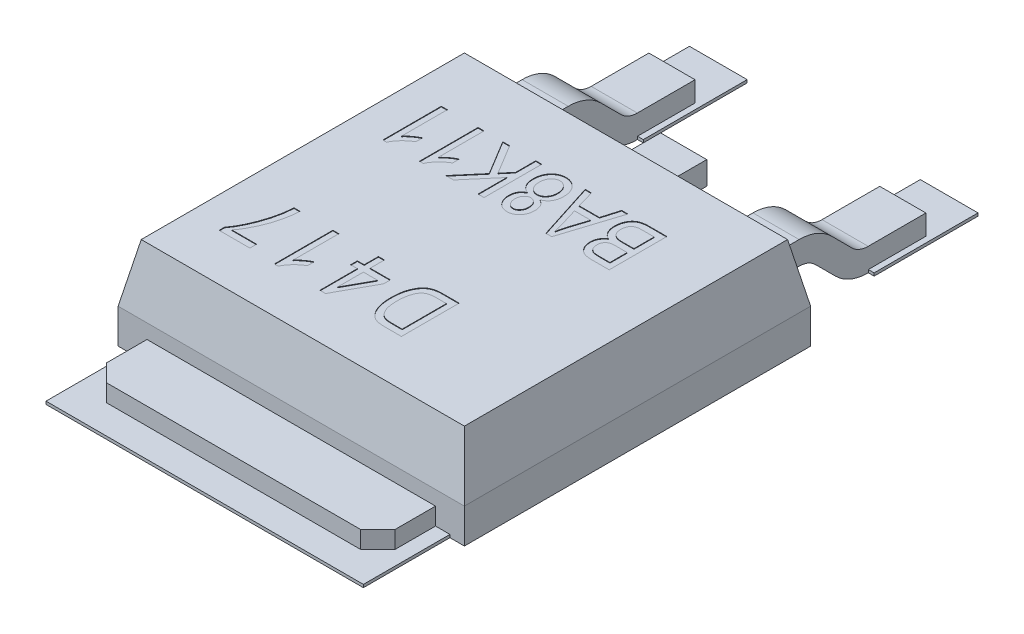
from build123d import *
from OCP.BRepFilletAPI import BRepFilletAPI_MakeChamfer

# Parameters (mm, degrees)
SKETCH1_W           = 6
SKETCH1_H           = 6
BOSS_EXTRUDE1_DEPTH = 1.6
CHAMFER1_SIZE       = 1
CHAMFER1_SIZE2      = 0.2
BOSS_EXTRU_1_DEPTH  = 0.35
SKETCH4_W           = 5.5
SKETCH4_H           = 2
SKETCH4_W_2         = 1
SKETCH4_H_2         = 1.8
BOSS_EXTRUDE2_DEPTH = 0.05
CUT_EXTRUDE1_DEPTH  = 0.01
CUT_EXTRUDE2_DEPTH  = 0.01
EXTRU_MINCE1_DEPTH  = 0.4
ESQUISSE3_W         = 1
ESQUISSE3_H         = 0.4
EXTRU_MINCE2_DEPTH  = 0.4


with BuildPart() as part:
    # Sketch1 → Boss-Extrude1 (new body)
    with BuildSketch(Plane(origin=(0, 0, 0), x_dir=(1, 0, 0), z_dir=(0, 1, 0))):
        Rectangle(SKETCH1_W, SKETCH1_H)
    extrude(amount=BOSS_EXTRUDE1_DEPTH)

    # Chamfer1: one chamfer whose edges measure the first distance from different faces: ONE call of the kernel's chamfer builder (chamfer() names one face for all edges)
    chamfer1_edges_1 = [part.edges().sort_by_distance(p)[0] for p in [
        (3, 1.6, 0),
    ]]
    chamfer1_side_1 = [part.faces().sort_by_distance(p)[0] for p in [
        (3, 0.8, 0),
    ]]
    chamfer1_edges_2 = [part.edges().sort_by_distance(p)[0] for p in [
        (0, 1.6, -3),
    ]]
    chamfer1_side_2 = [part.faces().sort_by_distance(p)[0] for p in [
        (0, 0.8, -3),
    ]]
    chamfer1_edges_3 = [part.edges().sort_by_distance(p)[0] for p in [
        (-3, 1.6, 0),
    ]]
    chamfer1_side_3 = [part.faces().sort_by_distance(p)[0] for p in [
        (-3, 0.8, 0),
    ]]
    chamfer1_edges_4 = [part.edges().sort_by_distance(p)[0] for p in [
        (0, 1.6, 3),
    ]]
    chamfer1_side_4 = [part.faces().sort_by_distance(p)[0] for p in [
        (0, 0.8, 3),
    ]]
    chamfer1 = BRepFilletAPI_MakeChamfer(part.part.solid().wrapped)
    for e in chamfer1_edges_1:
        chamfer1.Add(CHAMFER1_SIZE, CHAMFER1_SIZE2, e.wrapped, chamfer1_side_1[0].wrapped)  # the first distance lies on this face
    for e in chamfer1_edges_2:
        chamfer1.Add(CHAMFER1_SIZE, CHAMFER1_SIZE2, e.wrapped, chamfer1_side_2[0].wrapped)  # the first distance lies on this face
    for e in chamfer1_edges_3:
        chamfer1.Add(CHAMFER1_SIZE, CHAMFER1_SIZE2, e.wrapped, chamfer1_side_3[0].wrapped)  # the first distance lies on this face
    for e in chamfer1_edges_4:
        chamfer1.Add(CHAMFER1_SIZE, CHAMFER1_SIZE2, e.wrapped, chamfer1_side_4[0].wrapped)  # the first distance lies on this face
    add(Compound.cast(chamfer1.Shape()), mode=Mode.REPLACE)

    # Esquisse1 → Boss.-Extru.1 (add)
    with BuildSketch(Plane.XZ):
        Polygon((-2.5, 3), (-2.5, 3.7), (-2.2, 4), (2.2, 4), (2.5, 3.7), (2.5, 3), align=None)
    extrude(amount=-BOSS_EXTRU_1_DEPTH)

    # Sketch4 → Boss-Extrude2 (add)
    with BuildSketch(Plane(origin=(0, 0, 0), x_dir=(1, 0, 0), z_dir=(0, 1, 0))):
        with Locations((0, -3.5)):
            Rectangle(SKETCH4_W, SKETCH4_H)
        with Locations((-2, 5.5)):
            Rectangle(SKETCH4_W_2, SKETCH4_H_2)
        with Locations((2, 5.5)):
            Rectangle(SKETCH4_W_2, SKETCH4_H_2)
    extrude(amount=BOSS_EXTRUDE2_DEPTH)


with BuildPart() as boss_extrude2_piece_1:
    # of the separate pieces the step leaves, piece 1, a body of its own (boss_extrude2_pieces)
    add(part.part.solids().sort_by_distance((-3, 0.6, -3))[0])

    # Sketch5 → Cut-Extrude1 (cut)
    # profile 1 of 4: a face of its own
    with BuildSketch(Plane(origin=(0, 1.6, 0), x_dir=(1, 0, 0), z_dir=(0, 1, 0))):
        with BuildLine():
            Line((0.909090909, -1), (0.909090909, -2))
            Line((0.909090909, -2), (0.627232143, -2))
            add(Edge.make_bspline(
                [(0.627232143, -2), (0.618775412, -2.00000451), (0.60239621, -2.000013245), (0.578587199, -1.998844327), (0.556316091, -1.997536776), (0.535597034, -1.995541178), (0.516529087, -1.992843094), (0.498939821, -1.989939618), (0.482975595, -1.986074805), (0.472930515, -1.983000063), (0.468141234, -1.981534091)],
                knots=[0, 0, 0, 0, 1.262174937, 2.444611131, 3.557536157, 4.59237566, 5.550534478, 6.431992477, 7.252407118, 8, 8, 8, 8], degree=3))
            add(Edge.make_bspline(
                [(0.468141234, -1.981534091), (0.456481577, -1.977077241), (0.433154022, -1.96816039), (0.400785725, -1.948392912), (0.370967262, -1.923721279), (0.343505704, -1.894318821), (0.318800848, -1.860334626), (0.297135486, -1.822023974), (0.278003099, -1.779895789), (0.26197546, -1.733511256), (0.249196519, -1.682818235), (0.240254127, -1.627627934), (0.23471847, -1.568024588), (0.234090817, -1.526798491), (0.233766234, -1.505478896)],
                knots=[0, 0, 0, 0, 0.793570228, 1.587701398, 2.401757725, 3.251990999, 4.14284781, 5.070886882, 6.05016333, 7.085482446, 8.191842001, 9.375152492, 10.642590783, 12, 12, 12, 12], degree=3))
            add(Edge.make_bspline(
                [(0.233766234, -1.505478896), (0.233936524, -1.491609851), (0.234271511, -1.464327235), (0.236476558, -1.424242192), (0.240312254, -1.385711603), (0.245787602, -1.348883148), (0.252663112, -1.313580679), (0.261094381, -1.279946144), (0.271346301, -1.247947411), (0.282845805, -1.217593758), (0.295542964, -1.189045638), (0.309363547, -1.1626511), (0.323967898, -1.138314333), (0.339601771, -1.116289027), (0.355796369, -1.096150943), (0.373181339, -1.078498187), (0.391220094, -1.062685269), (0.410533963, -1.049188647), (0.431048809, -1.03758525), (0.452795028, -1.027390955), (0.476077229, -1.018828152), (0.500887314, -1.012045721), (0.527097788, -1.006515321), (0.554830261, -1.002702364), (0.584041134, -1.000496637), (0.604027564, -1.000168005), (0.61424513, -1)],
                knots=[0, 0, 0, 0, 1.386035777, 2.726552658, 4.010606465, 5.254366226, 6.446193604, 7.603690686, 8.717510246, 9.802231389, 10.846187194, 11.837930809, 12.77813523, 13.6802668, 14.53543628, 15.357642445, 16.153183888, 16.929597682, 17.707687034, 18.506066684, 19.327327497, 20.183458262, 21.074376462, 22.002646263, 22.978902547, 24, 24, 24, 24], degree=3))
            Line((0.61424513, -1), (0.909090909, -1))
        make_face()
        with BuildLine():
            Line((0.805194805, -1.116883117), (0.626826299, -1.116883117))
            add(Edge.make_bspline(
                [(0.626826299, -1.116883117), (0.618097699, -1.117005877), (0.601166151, -1.117244005), (0.576588709, -1.118906443), (0.553598984, -1.12141978), (0.53226459, -1.125313856), (0.512582747, -1.130105742), (0.494498004, -1.135992591), (0.478070061, -1.143079418), (0.463030763, -1.15126581), (0.44932786, -1.16069055), (0.436604076, -1.171408607), (0.424660749, -1.18336333), (0.413499295, -1.196621802), (0.403028313, -1.211046266), (0.393783985, -1.227072232), (0.384996644, -1.244233052), (0.3799878, -1.256386977), (0.377435065, -1.262581169)],
                knots=[0, 0, 0, 0, 1.342522454, 2.604195873, 3.787640691, 4.897837639, 5.937490788, 6.901507558, 7.81956877, 8.685632238, 9.531204737, 10.37312076, 11.241244131, 12.127141563, 13.036673505, 13.978826353, 14.969918024, 16, 16, 16, 16], degree=3))
            add(Edge.make_bspline(
                [(0.377435065, -1.262581169), (0.374235057, -1.271275904), (0.367767595, -1.28884863), (0.359550223, -1.316254887), (0.353107863, -1.344993201), (0.347201712, -1.374924433), (0.343189551, -1.406125809), (0.339760984, -1.438585087), (0.338026764, -1.472315755), (0.33778495, -1.495263627), (0.337662338, -1.506899351)],
                knots=[0, 0, 0, 0, 0.893151802, 1.805128209, 2.755850574, 3.731738016, 4.745334486, 5.787480394, 6.878141491, 8, 8, 8, 8], degree=3))
            add(Edge.make_bspline(
                [(0.337662338, -1.506899351), (0.337751243, -1.51928112), (0.337924325, -1.543386024), (0.340069251, -1.578512545), (0.343150431, -1.611578414), (0.347889282, -1.64258153), (0.353717899, -1.671581071), (0.3606963, -1.698616756), (0.369273581, -1.723571691), (0.379178025, -1.746475475), (0.390248858, -1.767369446), (0.401717861, -1.786658084), (0.414363885, -1.803853952), (0.42754419, -1.819364746), (0.441467336, -1.833160595), (0.456190791, -1.845094558), (0.471786112, -1.855222075), (0.48275985, -1.860566298), (0.488230519, -1.863230519)],
                knots=[0, 0, 0, 0, 1.456515219, 2.835552549, 4.138945756, 5.362336007, 6.523499621, 7.617953034, 8.644754834, 9.624918001, 10.550413316, 11.425253886, 12.262512803, 13.058355621, 13.818045382, 14.564998839, 15.284617782, 16, 16, 16, 16], degree=3))
            add(Edge.make_bspline(
                [(0.488230519, -1.863230519), (0.492196312, -1.864856582), (0.500541033, -1.868278102), (0.514225775, -1.872201089), (0.529448542, -1.875715827), (0.546367242, -1.878175199), (0.564826162, -1.880463596), (0.584997618, -1.882110126), (0.606800225, -1.882783141), (0.62188835, -1.883003351), (0.629667208, -1.883116883)],
                knots=[0, 0, 0, 0, 0.715292366, 1.505100173, 2.373764653, 3.322734101, 4.358121183, 5.480036167, 6.700803291, 8, 8, 8, 8], degree=3))
            Line((0.629667208, -1.883116883), (0.805194805, -1.883116883))
            Line((0.805194805, -1.883116883), (0.805194805, -1.116883117))
        make_face(mode=Mode.SUBTRACT)
    # profile 2 of 4: a face of its own
    with BuildSketch(Plane(origin=(0, 1.6, 0), x_dir=(1, 0, 0), z_dir=(0, 1, 0))):
        Polygon((-0.386363636, -1), (-0.386363636, -1.246753247), (-0.035714286, -1.246753247), (-0.035714286, -1.363636364), (-0.392248377, -2.012987013), (-0.49025974, -2.012987013), (-0.49025974, -1.363636364), (-0.607142857, -1.363636364), (-0.607142857, -1.246753247), (-0.49025974, -1.246753247), (-0.49025974, -1), align=None)
        Polygon((-0.386363636, -1.363636364), (-0.386363636, -1.815543831), (-0.138189935, -1.363636364), align=None, mode=Mode.SUBTRACT)
    # profile 3 of 4: a face of its own
    with BuildSketch(Plane(origin=(0, 1.6, 0), x_dir=(1, 0, 0), z_dir=(0, 1, 0))):
        with BuildLine():
            Line((-1.279220779, -1), (-1.175324675, -1))
            Line((-1.175324675, -1), (-1.175324675, -1.792207792))
            add(Edge.make_bspline(
                [(-1.175324675, -1.792207792), (-1.168941155, -1.784866534), (-1.155711315, -1.769651785), (-1.132836194, -1.747977094), (-1.107121801, -1.725961756), (-1.079062769, -1.70412581), (-1.050104506, -1.683443988), (-1.021591711, -1.665041869), (-0.994416181, -1.649140319), (-0.976251606, -1.640507471), (-0.967532468, -1.636363636)],
                knots=[0, 0, 0, 0, 0.892597597, 1.849907605, 2.889096657, 3.999508354, 5.112538398, 6.154543284, 7.114166246, 8, 8, 8, 8], degree=3))
            Line((-0.967532468, -1.636363636), (-0.967532468, -1.753246753))
            add(Edge.make_bspline(
                [(-0.967532468, -1.753246753), (-0.981542686, -1.761684938), (-1.009443158, -1.778489054), (-1.048633979, -1.807549853), (-1.085439436, -1.839249281), (-1.119295093, -1.873145958), (-1.149602414, -1.908063441), (-1.175168336, -1.943201804), (-1.196425732, -1.977703086), (-1.206826798, -2.00149514), (-1.211850649, -2.012987013)],
                knots=[0, 0, 0, 0, 1.082266703, 2.155266233, 3.225308806, 4.295585612, 5.324342242, 6.282751181, 7.17054637, 8, 8, 8, 8], degree=3))
            Line((-1.211850649, -2.012987013), (-1.279220779, -2.012987013))
            Line((-1.279220779, -2.012987013), (-1.279220779, -1))
        make_face()
    # profile 4 of 4: a face of its own
    with BuildSketch(Plane(origin=(0, 1.6, 0), x_dir=(1, 0, 0), z_dir=(0, 1, 0))):
        with BuildLine():
            Line((-1.730519481, -1.87012987), (-1.730519481, -1.987012987))
            Line((-1.730519481, -1.987012987), (-2.262987013, -1.987012987))
            Line((-2.262987013, -1.987012987), (-2.262987013, -1.891436688))
            add(Edge.make_bspline(
                [(-2.262987013, -1.891436688), (-2.253107587, -1.878210031), (-2.232998474, -1.851287786), (-2.204877796, -1.808222134), (-2.177523491, -1.762359182), (-2.150938602, -1.713647147), (-2.125334602, -1.662005922), (-2.100887544, -1.607370332), (-2.077158554, -1.54991053), (-2.054393858, -1.490126812), (-2.033180943, -1.428934513), (-2.014319685, -1.367266072), (-1.997878532, -1.305656703), (-1.983655189, -1.244287077), (-1.971819574, -1.183038154), (-1.962512462, -1.121977409), (-1.955512302, -1.060986446), (-1.952701618, -1.020305417), (-1.951298701, -1)],
                knots=[0, 0, 0, 0, 0.828261285, 1.685887316, 2.579428271, 3.507501538, 4.469891598, 5.471065063, 6.510494938, 7.589089173, 8.680758398, 9.759817177, 10.82439165, 11.879940066, 12.920405774, 13.953938893, 14.978734705, 16, 16, 16, 16], degree=3))
            Line((-1.951298701, -1), (-1.847402597, -1))
            add(Edge.make_bspline(
                [(-1.847402597, -1), (-1.847750245, -1.010689632), (-1.848459293, -1.032491751), (-1.850659887, -1.065872605), (-1.854401087, -1.100508476), (-1.859272188, -1.1365078), (-1.865445265, -1.173762929), (-1.872455889, -1.212439498), (-1.881062772, -1.252330181), (-1.894016685, -1.307156239), (-1.912517131, -1.375703545), (-1.93909059, -1.456512779), (-1.969148541, -1.535436954), (-2.003256405, -1.611554138), (-2.039186803, -1.684140455), (-2.07765803, -1.751351867), (-2.116488053, -1.813642595), (-2.145154103, -1.85165101), (-2.159090909, -1.87012987)],
                knots=[0, 0, 0, 0, 0.547564817, 1.116789984, 1.712252562, 2.330831182, 2.976456312, 3.645516887, 4.343080939, 5.06547646, 6.529779861, 7.976466419, 9.419056042, 10.851576025, 12.245448489, 13.563727135, 14.815537433, 16, 16, 16, 16], degree=3))
            Line((-2.159090909, -1.87012987), (-1.730519481, -1.87012987))
        make_face()
    extrude(amount=-CUT_EXTRUDE1_DEPTH, mode=Mode.SUBTRACT)

    # Sketch6 → Cut-Extrude2 (cut)
    # profile 1 of 6: a face of its own
    with BuildSketch(Plane(origin=(0, 1.6, 0), x_dir=(1, 0, 0), z_dir=(0, 1, 0))):
        with BuildLine():
            Line((1.709090909, 1.8), (1.709090909, 0.8))
            Line((1.709090909, 0.8), (1.399025974, 0.8))
            add(Edge.make_bspline(
                [(1.399025974, 0.8), (1.391379972, 0.800054737), (1.376479609, 0.800161407), (1.35474923, 0.801658249), (1.334234107, 0.803862586), (1.314898025, 0.806818804), (1.296886513, 0.810896293), (1.280041716, 0.815744905), (1.264459217, 0.821633249), (1.245258892, 0.830494742), (1.223120185, 0.844304649), (1.199134695, 0.864843401), (1.177779684, 0.889492317), (1.159040297, 0.917539877), (1.143625845, 0.948366452), (1.132659113, 0.981294216), (1.125938203, 1.015839329), (1.125101346, 1.039417471), (1.124675325, 1.051420455)],
                knots=[0, 0, 0, 0, 0.870762362, 1.696922705, 2.479694412, 3.220704395, 3.923519284, 4.58180529, 5.215744372, 5.818975064, 6.988484834, 8.174326093, 9.402850172, 10.691394685, 12.007628492, 13.315991423, 14.633645104, 16, 16, 16, 16], degree=3))
            add(Edge.make_bspline(
                [(1.124675325, 1.051420455), (1.125012224, 1.062469532), (1.125673818, 1.084167395), (1.131294903, 1.115801747), (1.140432431, 1.145758504), (1.153339228, 1.173770644), (1.169199712, 1.19991493), (1.18879568, 1.223013033), (1.210790177, 1.244063188), (1.227706367, 1.255327982), (1.236282468, 1.261038961)],
                knots=[0, 0, 0, 0, 1.067163608, 2.095665496, 3.094381775, 4.086055985, 5.069334826, 6.039400011, 7.006023047, 8, 8, 8, 8], degree=3))
            add(Edge.make_bspline(
                [(1.236282468, 1.261038961), (1.22600209, 1.265827966), (1.205531205, 1.275364113), (1.178368523, 1.29598836), (1.15440453, 1.320887189), (1.134393073, 1.35051673), (1.118310935, 1.384223727), (1.106796572, 1.421742795), (1.099812443, 1.462889136), (1.099080571, 1.49152962), (1.098701299, 1.506371753)],
                knots=[0, 0, 0, 0, 0.907806387, 1.807676924, 2.717428127, 3.670336734, 4.663211712, 5.703492116, 6.809898713, 8, 8, 8, 8], degree=3))
            add(Edge.make_bspline(
                [(1.098701299, 1.506371753), (1.099078652, 1.521283338), (1.099811987, 1.550262045), (1.106983705, 1.592270609), (1.118188705, 1.631554649), (1.134224832, 1.66761609), (1.154018015, 1.699906758), (1.177096466, 1.727895878), (1.203311481, 1.751153558), (1.227873534, 1.766535285), (1.249305953, 1.77614511), (1.266729866, 1.782748339), (1.285740342, 1.787857683), (1.306033096, 1.792382826), (1.327857783, 1.795816529), (1.351100626, 1.798103731), (1.375730043, 1.799903222), (1.39259649, 1.799967164), (1.401258117, 1.8)],
                knots=[0, 0, 0, 0, 1.483101461, 2.882213003, 4.228804869, 5.540004403, 6.797554673, 7.988070595, 9.137672878, 10.271731903, 10.856259808, 11.474079914, 12.124255131, 12.813652303, 13.543114926, 14.321609254, 15.138076009, 16, 16, 16, 16], degree=3))
            Line((1.401258117, 1.8), (1.709090909, 1.8))
        make_face()
        with BuildLine():
            Line((1.605194805, 1.215584416), (1.421753247, 1.215584416))
            add(Edge.make_bspline(
                [(1.421753247, 1.215584416), (1.410653992, 1.215504138), (1.390129319, 1.215355689), (1.361987025, 1.213421056), (1.338789187, 1.211138), (1.325406025, 1.207609396), (1.319480519, 1.206047078)],
                knots=[0, 0, 0, 0, 1.292436319, 2.38996507, 3.287143691, 4, 4, 4, 4], degree=3))
            add(Edge.make_bspline(
                [(1.319480519, 1.206047078), (1.312542258, 1.203575452), (1.298988065, 1.198747023), (1.28083443, 1.187697451), (1.26482608, 1.17461566), (1.251549462, 1.15881063), (1.240829716, 1.140289002), (1.233795941, 1.118658579), (1.229198572, 1.094228534), (1.228787545, 1.076944839), (1.228571429, 1.067857143)],
                knots=[0, 0, 0, 0, 0.985455176, 1.925129435, 2.833409245, 3.74751417, 4.678036112, 5.68496882, 6.782766118, 8, 8, 8, 8], degree=3))
            add(Edge.make_bspline(
                [(1.228571429, 1.067857143), (1.228830522, 1.059315913), (1.229327246, 1.042940959), (1.233478133, 1.019477123), (1.240087212, 0.998185735), (1.2494136, 0.979214978), (1.261076363, 0.962840987), (1.274599342, 0.949004357), (1.2899696, 0.93796315), (1.304319142, 0.930893334), (1.3173713, 0.927006428), (1.328912934, 0.924086669), (1.342370093, 0.921981149), (1.357544365, 0.920246836), (1.37444135, 0.918498491), (1.39313363, 0.917619635), (1.413564079, 0.916981608), (1.427772613, 0.916916766), (1.435146104, 0.916883117)],
                knots=[0, 0, 0, 0, 1.374823033, 2.635763691, 3.824462367, 4.954815379, 6.024974192, 7.049578075, 8.056420344, 9.060192966, 9.608067978, 10.247510764, 10.976465608, 11.799414685, 12.707848295, 13.711620916, 14.812450139, 16, 16, 16, 16], degree=3))
            Line((1.435146104, 0.916883117), (1.605194805, 0.916883117))
            Line((1.605194805, 0.916883117), (1.605194805, 1.215584416))
        make_face(mode=Mode.SUBTRACT)
        with BuildLine():
            Line((1.605194805, 1.683116883), (1.399025974, 1.683116883))
            add(Edge.make_bspline(
                [(1.399025974, 1.683116883), (1.388401593, 1.682961147), (1.368614295, 1.682671096), (1.341133252, 1.680603566), (1.31801264, 1.676848839), (1.304495734, 1.672503054), (1.298376623, 1.670535714)],
                knots=[0, 0, 0, 0, 1.250964288, 2.329849019, 3.243921745, 4, 4, 4, 4], degree=3))
            add(Edge.make_bspline(
                [(1.298376623, 1.670535714), (1.290859518, 1.667282728), (1.276193291, 1.660935997), (1.256844935, 1.647017306), (1.239879566, 1.630785821), (1.226253555, 1.611185955), (1.215635897, 1.588885306), (1.207946016, 1.564023054), (1.203532087, 1.536424303), (1.202917918, 1.517210521), (1.202597403, 1.507183442)],
                knots=[0, 0, 0, 0, 0.967993686, 1.888601442, 2.806833432, 3.738608885, 4.699374536, 5.72357697, 6.812005123, 8, 8, 8, 8], degree=3))
            add(Edge.make_bspline(
                [(1.202597403, 1.507183442), (1.202829078, 1.497896151), (1.203276768, 1.479949339), (1.207868279, 1.454178508), (1.215104403, 1.430588423), (1.225295109, 1.409313134), (1.238065552, 1.390582178), (1.253137342, 1.374614588), (1.26987555, 1.36091141), (1.285804804, 1.352046381), (1.299981138, 1.346382429), (1.312025001, 1.342524545), (1.325641811, 1.339588785), (1.340523686, 1.336941513), (1.356848319, 1.334921668), (1.374525439, 1.333613795), (1.393600033, 1.332453516), (1.406802604, 1.332462752), (1.413636364, 1.332467532)],
                knots=[0, 0, 0, 0, 1.410573788, 2.725800822, 3.964903627, 5.151480749, 6.298041429, 7.396564004, 8.478942006, 9.57457322, 10.151232655, 10.798392405, 11.494360327, 12.266936039, 13.095957466, 13.993447348, 14.961391824, 16, 16, 16, 16], degree=3))
            Line((1.413636364, 1.332467532), (1.605194805, 1.332467532))
            Line((1.605194805, 1.332467532), (1.605194805, 1.683116883))
        make_face(mode=Mode.SUBTRACT)
    # profile 2 of 6: a face of its own
    with BuildSketch(Plane(origin=(0, 1.6, 0), x_dir=(1, 0, 0), z_dir=(0, 1, 0))):
        Polygon((1.033766234, 1.8), (0.714366883, 0.8), (0.613108766, 0.8), (0.293506494, 1.8), (0.401461039, 1.8), (0.488920455, 1.501298701), (0.838352273, 1.501298701), (0.925608766, 1.8), align=None)
        with BuildLine():
            Line((0.804261364, 1.384415584), (0.523214286, 1.384415584))
            Line((0.523214286, 1.384415584), (0.606818182, 1.109659091))
            add(Edge.make_bspline(
                [(0.606818182, 1.109659091), (0.609943302, 1.099381806), (0.616044644, 1.079316904), (0.624726603, 1.049947394), (0.632908616, 1.022030462), (0.640419515, 0.99560057), (0.647062127, 0.970607104), (0.653235429, 0.947157072), (0.658669278, 0.925160817), (0.662024566, 0.910933488), (0.663636364, 0.904099026)],
                knots=[0, 0, 0, 0, 1.208585302, 2.359586633, 3.44573617, 4.481694954, 5.45087266, 6.355352717, 7.20995158, 8, 8, 8, 8], degree=3))
            add(Edge.make_bspline(
                [(0.663636364, 0.904099026), (0.666559949, 0.920019234), (0.672403236, 0.951838502), (0.683356248, 0.999239199), (0.695541806, 1.04655436), (0.705241061, 1.077769848), (0.710105519, 1.093425325)],
                knots=[0, 0, 0, 0, 0.995500629, 1.989678841, 2.991765375, 4, 4, 4, 4], degree=3))
            Line((0.710105519, 1.093425325), (0.804261364, 1.384415584))
        make_face(mode=Mode.SUBTRACT)
    # profile 3 of 6: a face of its own
    with BuildSketch(Plane(origin=(0, 1.6, 0), x_dir=(1, 0, 0), z_dir=(0, 1, 0))):
        with BuildLine():
            add(Edge.make_bspline(
                [(0.055073052, 1.251298701), (0.06462921, 1.246491383), (0.083273438, 1.237112222), (0.108139677, 1.218830253), (0.12914444, 1.19737835), (0.146566292, 1.172965679), (0.160360127, 1.145492643), (0.169686672, 1.114812189), (0.175815864, 1.081223702), (0.176347218, 1.057740526), (0.176623377, 1.045535714)],
                knots=[0, 0, 0, 0, 1.008509637, 1.967619574, 2.89776806, 3.831547644, 4.788167516, 5.785783694, 6.849214744, 8, 8, 8, 8], degree=3))
            add(Edge.make_bspline(
                [(0.176623377, 1.045535714), (0.176437496, 1.036192949), (0.176074127, 1.01792923), (0.172968249, 0.99118185), (0.167878134, 0.96582057), (0.161102457, 0.941683442), (0.151850327, 0.919021466), (0.140609062, 0.89768413), (0.127678992, 0.87738583), (0.112439714, 0.85891933), (0.095911173, 0.842089289), (0.078177815, 0.827378272), (0.059412853, 0.814910076), (0.039612401, 0.804691252), (0.018781155, 0.796754339), (-0.003104633, 0.790979993), (-0.02607062, 0.787808644), (-0.041711805, 0.78728051), (-0.04963474, 0.787012987)],
                knots=[0, 0, 0, 0, 1.165741532, 2.278851694, 3.354982323, 4.391648623, 5.402771003, 6.403407807, 7.398581389, 8.400606014, 9.38555839, 10.33889109, 11.270751962, 12.191998689, 13.113864065, 14.047558559, 15.011004111, 16, 16, 16, 16], degree=3))
            add(Edge.make_bspline(
                [(-0.04963474, 0.787012987), (-0.057628477, 0.787257493), (-0.073420297, 0.787740521), (-0.096550565, 0.79124631), (-0.118652568, 0.796951233), (-0.13974026, 0.804861825), (-0.159695435, 0.815329769), (-0.178664421, 0.827989647), (-0.196651133, 0.84291662), (-0.213354584, 0.860076787), (-0.228476677, 0.879063823), (-0.241802257, 0.899480577), (-0.252942164, 0.921272034), (-0.262145499, 0.94436096), (-0.269241336, 0.968830901), (-0.274246983, 0.994639674), (-0.27736951, 1.021717189), (-0.277735543, 1.040183505), (-0.277922078, 1.049594156)],
                knots=[0, 0, 0, 0, 0.984942696, 1.945778183, 2.875853341, 3.793971666, 4.714923987, 5.646678758, 6.59981698, 7.590177482, 8.592638326, 9.586885563, 10.589796896, 11.603734109, 12.645759419, 13.72477449, 14.840518438, 16, 16, 16, 16], degree=3))
            add(Edge.make_bspline(
                [(-0.277922078, 1.049594156), (-0.277623933, 1.061322759), (-0.277049626, 1.083915245), (-0.271179536, 1.116373217), (-0.26194147, 1.146057318), (-0.248872785, 1.173038658), (-0.231761321, 1.197212749), (-0.21060629, 1.218269845), (-0.185967661, 1.23704401), (-0.16723645, 1.246452851), (-0.157589286, 1.251298701)],
                knots=[0, 0, 0, 0, 1.126050265, 2.169079615, 3.157896424, 4.105607084, 5.038058818, 5.989507118, 6.964532763, 8, 8, 8, 8], degree=3))
            add(Edge.make_bspline(
                [(-0.157589286, 1.251298701), (-0.163863221, 1.253825326), (-0.176231325, 1.258806179), (-0.193694264, 1.268119642), (-0.210261126, 1.278221263), (-0.225636349, 1.289600489), (-0.239975187, 1.301999742), (-0.253009459, 1.315720356), (-0.264955392, 1.330559912), (-0.275937671, 1.34638906), (-0.285802125, 1.36328233), (-0.29396598, 1.381383717), (-0.30120549, 1.400307772), (-0.306800686, 1.420303094), (-0.311283836, 1.441245123), (-0.314456736, 1.463142164), (-0.316616901, 1.486036367), (-0.316792954, 1.501631656), (-0.316883117, 1.509618506)],
                knots=[0, 0, 0, 0, 0.998651006, 1.968687807, 2.92001032, 3.863478588, 4.791415673, 5.717413269, 6.655466888, 7.60358177, 8.561808628, 9.541119464, 10.534204117, 11.552808826, 12.605410886, 13.696544253, 14.820325946, 16, 16, 16, 16], degree=3))
            add(Edge.make_bspline(
                [(-0.316883117, 1.509618506), (-0.316663065, 1.520520039), (-0.316231243, 1.54191283), (-0.312439175, 1.573184234), (-0.306647737, 1.603015311), (-0.29832938, 1.631293039), (-0.287576764, 1.658036037), (-0.274229477, 1.683094202), (-0.258839409, 1.706796325), (-0.240962695, 1.72858043), (-0.221513755, 1.748346409), (-0.200588919, 1.765556267), (-0.17861842, 1.780268663), (-0.155390732, 1.792391575), (-0.130846761, 1.801406032), (-0.105347592, 1.80828286), (-0.078630747, 1.812079167), (-0.060468204, 1.81268155), (-0.051258117, 1.812987013)],
                knots=[0, 0, 0, 0, 1.159839339, 2.276028545, 3.347612162, 4.390892238, 5.408217009, 6.409728542, 7.408078517, 8.410986246, 9.403635706, 10.354881406, 11.289307082, 12.213387266, 13.136008139, 14.066710435, 15.019643562, 16, 16, 16, 16], degree=3))
            add(Edge.make_bspline(
                [(-0.051258117, 1.812987013), (-0.041912383, 1.812684937), (-0.023546717, 1.812091316), (0.003434463, 1.808274575), (0.029089632, 1.801452219), (0.053723163, 1.792332286), (0.077089426, 1.780341376), (0.099097415, 1.765482672), (0.1202067, 1.748421154), (0.139666409, 1.728576225), (0.157560972, 1.706701961), (0.173199517, 1.683001557), (0.186263619, 1.657510294), (0.197063592, 1.630485334), (0.205289841, 1.601701102), (0.211497041, 1.571330766), (0.214838686, 1.539252774), (0.21533269, 1.517336533), (0.215584416, 1.506168831)],
                knots=[0, 0, 0, 0, 0.98489838, 1.935462181, 2.863853923, 3.777350714, 4.698628449, 5.623813301, 6.571164825, 7.553997668, 8.546987334, 9.545334758, 10.539960322, 11.560453443, 12.607097128, 13.690449471, 14.823138845, 16, 16, 16, 16], degree=3))
            add(Edge.make_bspline(
                [(0.215584416, 1.506168831), (0.215483834, 1.497980693), (0.2152865, 1.481916075), (0.21325521, 1.458316252), (0.209689433, 1.435866449), (0.205477, 1.414399622), (0.19914804, 1.394217724), (0.192025374, 1.374918019), (0.183215971, 1.356843904), (0.17328675, 1.339912169), (0.162066167, 1.324294868), (0.149938938, 1.309823435), (0.136633024, 1.296775908), (0.122373352, 1.284976186), (0.107119449, 1.27429625), (0.090667318, 1.265269324), (0.073296389, 1.257438759), (0.061199065, 1.253362762), (0.055073052, 1.251298701)],
                knots=[0, 0, 0, 0, 1.21069923, 2.375316522, 3.498562823, 4.571653073, 5.606389256, 6.622587272, 7.611287731, 8.575394897, 9.521906623, 10.45172785, 11.364169739, 12.273481081, 13.186361486, 14.113218831, 15.04454532, 16, 16, 16, 16], degree=3))
        make_face()
        with BuildLine():
            add(Edge.make_bspline(
                [(0.072727273, 1.042694805), (0.072334718, 1.05429437), (0.071583593, 1.076489257), (0.064929041, 1.107992264), (0.053449067, 1.135714129), (0.037780811, 1.159333908), (0.019006055, 1.17864292), (-0.002496631, 1.192537149), (-0.026199418, 1.201248377), (-0.04279643, 1.202141871), (-0.051258117, 1.202597403)],
                knots=[0, 0, 0, 0, 1.231842103, 2.357036451, 3.401085995, 4.401996228, 5.352590176, 6.24195284, 7.103691345, 8, 8, 8, 8], degree=3))
            add(Edge.make_bspline(
                [(-0.051258117, 1.202597403), (-0.05951953, 1.202139944), (-0.075790566, 1.20123897), (-0.099014689, 1.192463158), (-0.120261404, 1.178815235), (-0.13902922, 1.160008749), (-0.154588469, 1.1370931), (-0.166145949, 1.110655796), (-0.172858563, 1.080972077), (-0.173627121, 1.060181013), (-0.174025974, 1.049391234)],
                knots=[0, 0, 0, 0, 0.904469837, 1.78137328, 2.690563844, 3.66281761, 4.679099383, 5.717479744, 6.815457862, 8, 8, 8, 8], degree=3))
            add(Edge.make_bspline(
                [(-0.174025974, 1.049391234), (-0.173647026, 1.038259859), (-0.172915732, 1.01677852), (-0.16591102, 0.986120949), (-0.154266296, 0.958653161), (-0.1382652, 0.934956367), (-0.11912781, 0.915587535), (-0.097707501, 0.901483499), (-0.0744582, 0.892499958), (-0.058235954, 0.891443039), (-0.050040584, 0.890909091)],
                knots=[0, 0, 0, 0, 1.194512566, 2.305171441, 3.356745246, 4.382694336, 5.359056102, 6.262072859, 7.122010972, 8, 8, 8, 8], degree=3))
            add(Edge.make_bspline(
                [(-0.050040584, 0.890909091), (-0.041851708, 0.8913798), (-0.025658138, 0.892310631), (-0.002461566, 0.900962101), (0.018588946, 0.914991475), (0.03731905, 0.933958771), (0.053037881, 0.956875073), (0.064473297, 0.983104616), (0.071635735, 1.012013395), (0.072355133, 1.032234538), (0.072727273, 1.042694805)],
                knots=[0, 0, 0, 0, 0.904441632, 1.788540613, 2.702983884, 3.688499748, 4.723534326, 5.763574655, 6.843111586, 8, 8, 8, 8], degree=3))
        make_face(mode=Mode.SUBTRACT)
        with BuildLine():
            add(Edge.make_bspline(
                [(0.111688312, 1.505762987), (0.111524855, 1.5132094), (0.111204621, 1.527797932), (0.108926213, 1.549093346), (0.105366907, 1.569280394), (0.100081212, 1.588318755), (0.093066519, 1.606154632), (0.085061755, 1.623134625), (0.07527625, 1.638883343), (0.063808316, 1.653089993), (0.051838681, 1.666365736), (0.03880998, 1.677682585), (0.025289244, 1.687333129), (0.011221728, 1.695415786), (-0.003647745, 1.701391205), (-0.018973462, 1.705970956), (-0.034927846, 1.708679191), (-0.045769056, 1.708952519), (-0.051258117, 1.709090909)],
                knots=[0, 0, 0, 0, 1.230277288, 2.410279697, 3.534938767, 4.614252728, 5.668684243, 6.698481287, 7.712631841, 8.723327437, 9.712029744, 10.662530755, 11.568139775, 12.45401456, 13.336144453, 14.209736028, 15.093563688, 16, 16, 16, 16], degree=3))
            add(Edge.make_bspline(
                [(-0.051258117, 1.709090909), (-0.056817292, 1.708963543), (-0.067731038, 1.708713499), (-0.083766298, 1.705875442), (-0.099170076, 1.701713084), (-0.113916557, 1.695723865), (-0.128053214, 1.68818963), (-0.141437667, 1.678815971), (-0.154133938, 1.667646261), (-0.166222103, 1.65505418), (-0.177095103, 1.640856214), (-0.186750386, 1.625537858), (-0.194806787, 1.609044289), (-0.201619848, 1.591501373), (-0.206610615, 1.572699829), (-0.210242269, 1.552751293), (-0.212499031, 1.53165282), (-0.212822088, 1.517199877), (-0.212987013, 1.509821429)],
                knots=[0, 0, 0, 0, 0.929227775, 1.824255418, 2.716702898, 3.59526155, 4.481442626, 5.392008749, 6.322614179, 7.307331295, 8.307986617, 9.309793516, 10.332294943, 11.374895993, 12.453967651, 13.581744353, 14.765443515, 16, 16, 16, 16], degree=3))
            add(Edge.make_bspline(
                [(-0.212987013, 1.509821429), (-0.212825994, 1.502374254), (-0.212510536, 1.48778423), (-0.210197965, 1.466499491), (-0.206756782, 1.446256252), (-0.201041542, 1.427357669), (-0.19448163, 1.409325094), (-0.186108435, 1.392498558), (-0.176307031, 1.376694291), (-0.165047429, 1.362238808), (-0.152657864, 1.349276291), (-0.139620095, 1.337874089), (-0.126064017, 1.327909437), (-0.111562464, 1.320381749), (-0.096753056, 1.314074927), (-0.081297759, 1.309635315), (-0.065154711, 1.306899673), (-0.054177576, 1.306630023), (-0.04862013, 1.306493506)],
                knots=[0, 0, 0, 0, 1.225324996, 2.400577485, 3.520709413, 4.598729305, 5.644955949, 6.675489348, 7.685557594, 8.700948627, 9.685167563, 10.631842478, 11.549334861, 12.445786057, 13.314078984, 14.194841507, 15.086093831, 16, 16, 16, 16], degree=3))
            add(Edge.make_bspline(
                [(-0.04862013, 1.306493506), (-0.043131334, 1.306633125), (-0.032290645, 1.30690888), (-0.016396653, 1.309588502), (-0.00120433, 1.314185917), (0.013406881, 1.320200181), (0.027394422, 1.328087637), (0.040820475, 1.337573599), (0.053376934, 1.349111445), (0.065335315, 1.362015849), (0.076203028, 1.376354425), (0.085846556, 1.39178486), (0.09367106, 1.408417994), (0.100507898, 1.425844531), (0.105474181, 1.444445022), (0.109201237, 1.463967583), (0.111131228, 1.484553099), (0.111499905, 1.498589749), (0.111688312, 1.505762987)],
                knots=[0, 0, 0, 0, 0.923492223, 1.823950378, 2.703058822, 3.591265275, 4.478303035, 5.400952399, 6.352317099, 7.343532326, 8.359299095, 9.376851492, 10.400565732, 11.449492684, 12.524126907, 13.6363541, 14.792091094, 16, 16, 16, 16], degree=3))
        make_face(mode=Mode.SUBTRACT)
    # profile 4 of 6: a face of its own
    with BuildSketch(Plane(origin=(0, 1.6, 0), x_dir=(1, 0, 0), z_dir=(0, 1, 0))):
        Polygon((-0.45974026, 1.8), (-0.45974026, 0.8), (-0.563636364, 0.8), (-0.563636364, 1.298173701), (-0.987743506, 0.8), (-1.120048701, 0.8), (-0.774675325, 1.205641234), (-1.135064935, 1.8), (-1.015746753, 1.8), (-0.70487013, 1.287621753), (-0.563636364, 1.453409091), (-0.563636364, 1.8), align=None)
    # profile 5 of 6: a face of its own
    with BuildSketch(Plane(origin=(0, 1.6, 0), x_dir=(1, 0, 0), z_dir=(0, 1, 0))):
        with BuildLine():
            Line((-1.563636364, 1.8), (-1.45974026, 1.8))
            Line((-1.45974026, 1.8), (-1.45974026, 1.007792208))
            add(Edge.make_bspline(
                [(-1.45974026, 1.007792208), (-1.453356739, 1.015133466), (-1.440126899, 1.030348215), (-1.417251778, 1.052022906), (-1.391537385, 1.074038244), (-1.363478353, 1.09587419), (-1.334520091, 1.116556012), (-1.306007295, 1.134958131), (-1.278831766, 1.150859681), (-1.260667191, 1.159492529), (-1.251948052, 1.163636364)],
                knots=[0, 0, 0, 0, 0.892597597, 1.849907605, 2.889096657, 3.999508354, 5.112538398, 6.154543284, 7.114166246, 8, 8, 8, 8], degree=3))
            Line((-1.251948052, 1.163636364), (-1.251948052, 1.046753247))
            add(Edge.make_bspline(
                [(-1.251948052, 1.046753247), (-1.265958271, 1.038315062), (-1.293858742, 1.021510946), (-1.333049564, 0.992450147), (-1.369855021, 0.960750719), (-1.403710677, 0.926854042), (-1.434017998, 0.891936559), (-1.45958392, 0.856798196), (-1.480841317, 0.822296914), (-1.491242383, 0.79850486), (-1.496266234, 0.787012987)],
                knots=[0, 0, 0, 0, 1.082266703, 2.155266233, 3.225308806, 4.295585612, 5.324342242, 6.282751181, 7.17054637, 8, 8, 8, 8], degree=3))
            Line((-1.496266234, 0.787012987), (-1.563636364, 0.787012987))
            Line((-1.563636364, 0.787012987), (-1.563636364, 1.8))
        make_face()
    # profile 6 of 6: a face of its own
    with BuildSketch(Plane(origin=(0, 1.6, 0), x_dir=(1, 0, 0), z_dir=(0, 1, 0))):
        with BuildLine():
            Line((-2.2, 1.8), (-2.096103896, 1.8))
            Line((-2.096103896, 1.8), (-2.096103896, 1.007792208))
            add(Edge.make_bspline(
                [(-2.096103896, 1.007792208), (-2.089720375, 1.015133466), (-2.076490535, 1.030348215), (-2.053615415, 1.052022906), (-2.027901022, 1.074038244), (-1.99984199, 1.09587419), (-1.970883727, 1.116556012), (-1.942370932, 1.134958131), (-1.915195402, 1.150859681), (-1.897030827, 1.159492529), (-1.888311688, 1.163636364)],
                knots=[0, 0, 0, 0, 0.892597597, 1.849907605, 2.889096657, 3.999508354, 5.112538398, 6.154543284, 7.114166246, 8, 8, 8, 8], degree=3))
            Line((-1.888311688, 1.163636364), (-1.888311688, 1.046753247))
            add(Edge.make_bspline(
                [(-1.888311688, 1.046753247), (-1.902321907, 1.038315062), (-1.930222379, 1.021510946), (-1.9694132, 0.992450147), (-2.006218657, 0.960750719), (-2.040074313, 0.926854042), (-2.070381635, 0.891936559), (-2.095947556, 0.856798196), (-2.117204953, 0.822296914), (-2.127606019, 0.79850486), (-2.13262987, 0.787012987)],
                knots=[0, 0, 0, 0, 1.082266703, 2.155266233, 3.225308806, 4.295585612, 5.324342242, 6.282751181, 7.17054637, 8, 8, 8, 8], degree=3))
            Line((-2.13262987, 0.787012987), (-2.2, 0.787012987))
            Line((-2.2, 0.787012987), (-2.2, 1.8))
        make_face()
    extrude(amount=-CUT_EXTRUDE2_DEPTH, mode=Mode.SUBTRACT)



with BuildPart() as boss_extrude2_piece_2:
    # of the separate pieces the step leaves, piece 2, a body of its own (boss_extrude2_pieces)
    add(part.part.solids().sort_by_distance((-2.5, 0, -6.4))[0])


with BuildPart() as boss_extrude2_piece_3:
    # of the separate pieces the step leaves, piece 3, a body of its own (boss_extrude2_pieces)
    add(part.part.solids().sort_by_distance((1.5, 0, -6.4))[0])


with BuildPart() as boss_extrude2_piece_1_1:
    add(boss_extrude2_piece_1.part)

    add(boss_extrude2_piece_3.part)  # Extru.-Mince1 merges Boss-Extrude2 piece 3
    # Esquisse2 → Extru.-Mince1 (add, symmetric)
    with BuildSketch(Plane(origin=(2, 0, 0), x_dir=(0, 0, -1), z_dir=(1, 0, 0))):
        with BuildLine():
            Line((2.8, 0.7), (3.4, 0.7))
            ThreePointArc((3.4, 0.7), (3.553073373, 0.669551813), (3.682842712, 0.582842712))
            Line((3.682842712, 0.582842712), (4.03137085, 0.234314575))
            ThreePointArc((4.03137085, 0.234314575), (4.290909529, 0.060896374), (4.597056275, 0))
            Line((4.597056275, 0), (5.597056275, 0))
            Line((5.597056275, 0), (5.597056275, 0.4))
            Line((5.597056275, 0.4), (4.597056275, 0.4))
            ThreePointArc((4.597056275, 0.4), (4.443982902, 0.430448187), (4.314213562, 0.517157288))
            Line((4.314213562, 0.517157288), (3.965685425, 0.865685425))
            ThreePointArc((3.965685425, 0.865685425), (3.706146746, 1.039103626), (3.4, 1.1))
            Line((3.4, 1.1), (2.8, 1.1))
            Line((2.8, 1.1), (2.8, 0.7))
        make_face()
    extru_mince1 = extrude(amount=EXTRU_MINCE1_DEPTH, both=True)

    # Symétrie1: Extru.-Mince1 across plane
    add(extru_mince1.mirror(Plane(origin=(0, 0, 0), x_dir=(0, 0, 1), z_dir=(1, 0, 0))))

    # Esquisse3 → Extru.-Mince2 (add, symmetric)
    with BuildSketch(Plane(origin=(0, 0, 0), x_dir=(0, 0, -1), z_dir=(1, 0, 0))):
        with Locations((3.3, 0.9)):
            Rectangle(ESQUISSE3_W, ESQUISSE3_H)
    extrude(amount=EXTRU_MINCE2_DEPTH, both=True)


solid = Compound([boss_extrude2_piece_2.part, boss_extrude2_piece_1_1.part])
